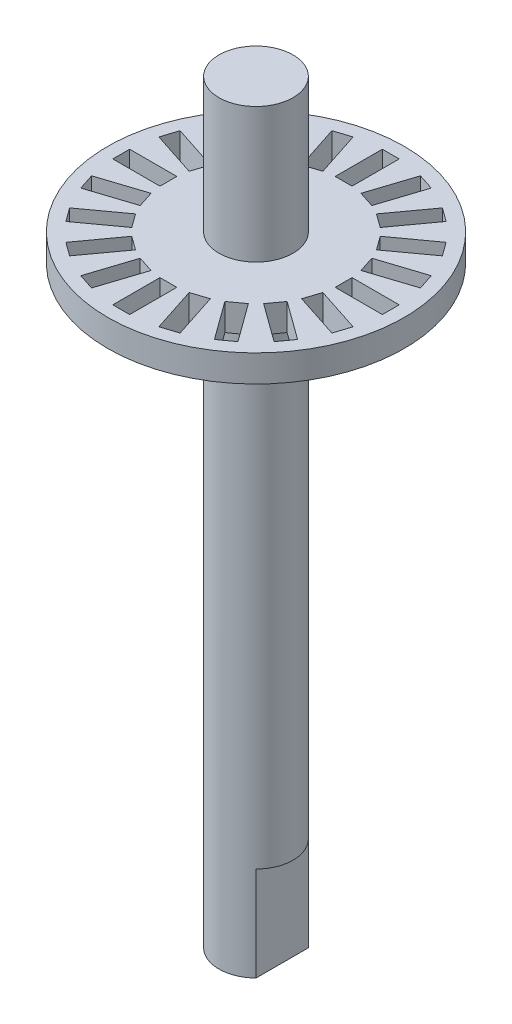
from build123d import *
from build123d.topology import SkipClean

# Parameters (mm, degrees)
SKETCH_1_R      = 2.75
EXTRUDE_1_DEPTH = 49
EXTRUDE_START   = 7
EXTRUDE_2_DEPTH = 7
EXTRUDE_START_2 = -12
SKETCH_6_R      = 11
SKETCH_6_W      = 1.25
SKETCH_6_H      = 3.5
SKETCH_6_W_2    = 3.5
SKETCH_6_H_2    = 1.25
EXTRUDE_4_DEPTH = 2


with BuildPart() as part:
    # 草图1 → 凸台-拉伸1 (new body)
    with BuildSketch(Plane(origin=(0, 0, 0), x_dir=(1, 0, 0), z_dir=(0, 1, 0))):
        Circle(SKETCH_1_R)
    extrude(amount=EXTRUDE_1_DEPTH)

    # 草图2 → 凸台-拉伸2 (add)
    with SkipClean():  # the faces are left unmerged after this step: merging them gives an invalid solid
        with BuildSketch(Plane.XZ.offset(EXTRUDE_START)):
            with BuildLine():
                Line((-1.95, 1.939071943), (-1.95, -1.939071943))
                ThreePointArc((-1.95, -1.939071943), (0, -2.75), (1.95, -1.939071943))
                Line((1.95, -1.939071943), (1.95, 1.939071943))
                ThreePointArc((1.95, 1.939071943), (0, 2.75), (-1.95, 1.939071943))
            make_face()
        extrude(amount=-EXTRUDE_2_DEPTH)

    # 草图6 → 凸台-拉伸4 (add)
    with SkipClean():  # the faces are left unmerged after this step: merging them gives an invalid solid
        with BuildSketch(Plane(origin=(0, 49, 0), x_dir=(1, 0, 0), z_dir=(0, 1, 0)).offset(EXTRUDE_START_2)):
            Circle(SKETCH_6_R)
            Polygon((2.495759621, 9.703700784), (3.684580266, 9.317429541), (2.603020786, 5.988731734), (1.414200141, 6.375002977), align=None, mode=Mode.SUBTRACT)
            with Locations((0, 8.25)):
                Rectangle(SKETCH_6_W, SKETCH_6_H, mode=Mode.SUBTRACT)
            Polygon((5.372216901, 8.457535726), (6.383488144, 7.722804161), (4.326239761, 4.891244681), (3.314968518, 5.625976246), align=None, mode=Mode.SUBTRACT)
            Polygon((7.722804161, 6.383488144), (8.457535726, 5.372216901), (5.625976246, 3.314968518), (4.891244681, 4.326239761), align=None, mode=Mode.SUBTRACT)
            Polygon((9.317429541, 3.684580266), (9.703700784, 2.495759621), (6.375002977, 1.414200141), (5.988731734, 2.603020786), align=None, mode=Mode.SUBTRACT)
            with Locations((8.25, 0)):
                Rectangle(SKETCH_6_W_2, SKETCH_6_H_2, mode=Mode.SUBTRACT)
            Polygon((9.703700784, -2.495759621), (9.317429541, -3.684580266), (5.988731734, -2.603020786), (6.375002977, -1.414200141), align=None, mode=Mode.SUBTRACT)
            Polygon((8.457535726, -5.372216901), (7.722804161, -6.383488144), (4.891244681, -4.326239761), (5.625976246, -3.314968518), align=None, mode=Mode.SUBTRACT)
            Polygon((6.383488144, -7.722804161), (5.372216901, -8.457535726), (3.314968518, -5.625976246), (4.326239761, -4.891244681), align=None, mode=Mode.SUBTRACT)
            Polygon((3.684580266, -9.317429541), (2.495759621, -9.703700784), (1.414200141, -6.375002977), (2.603020786, -5.988731734), align=None, mode=Mode.SUBTRACT)
            with Locations((0, -8.25)):
                Rectangle(SKETCH_6_W, SKETCH_6_H, mode=Mode.SUBTRACT)
            Polygon((-2.495759621, -9.703700784), (-3.684580266, -9.317429541), (-2.603020786, -5.988731734), (-1.414200141, -6.375002977), align=None, mode=Mode.SUBTRACT)
            Polygon((-5.372216901, -8.457535726), (-6.383488144, -7.722804161), (-4.326239761, -4.891244681), (-3.314968518, -5.625976246), align=None, mode=Mode.SUBTRACT)
            Polygon((-7.722804161, -6.383488144), (-8.457535726, -5.372216901), (-5.625976246, -3.314968518), (-4.891244681, -4.326239761), align=None, mode=Mode.SUBTRACT)
            Polygon((-9.317429541, -3.684580266), (-9.703700784, -2.495759621), (-6.375002977, -1.414200141), (-5.988731734, -2.603020786), align=None, mode=Mode.SUBTRACT)
            with Locations((-8.25, 0)):
                Rectangle(SKETCH_6_W_2, SKETCH_6_H_2, mode=Mode.SUBTRACT)
            Polygon((-9.703700784, 2.495759621), (-9.317429541, 3.684580266), (-5.988731734, 2.603020786), (-6.375002977, 1.414200141), align=None, mode=Mode.SUBTRACT)
            Polygon((-8.457535726, 5.372216901), (-7.722804161, 6.383488144), (-4.891244681, 4.326239761), (-5.625976246, 3.314968518), align=None, mode=Mode.SUBTRACT)
            Polygon((-6.383488144, 7.722804161), (-5.372216901, 8.457535726), (-3.314968518, 5.625976246), (-4.326239761, 4.891244681), align=None, mode=Mode.SUBTRACT)
            Polygon((-3.684580266, 9.317429541), (-2.495759621, 9.703700784), (-1.414200141, 6.375002977), (-2.603020786, 5.988731734), align=None, mode=Mode.SUBTRACT)
        extrude(amount=EXTRUDE_4_DEPTH)


solid = part.part
